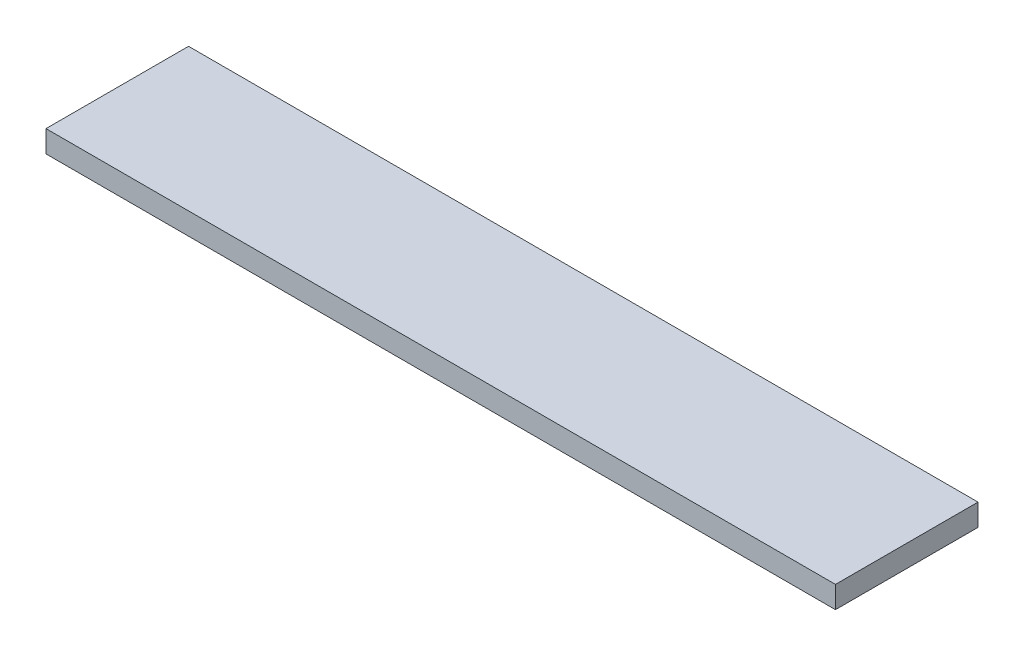
from build123d import *

# Parameters (mm, degrees)
ESQUISSE1_W        = 457.2
ESQUISSE1_H        = 82.55
BOSS_EXTRU_1_DEPTH = 12.7


with BuildPart() as part:
    # Esquisse1 → Boss.-Extru.1 (new body)
    with BuildSketch(Plane(origin=(0, 0, 0), x_dir=(1, 0, 0), z_dir=(0, 1, 0))):
        Rectangle(ESQUISSE1_W, ESQUISSE1_H)
    extrude(amount=BOSS_EXTRU_1_DEPTH)


solid = part.part
